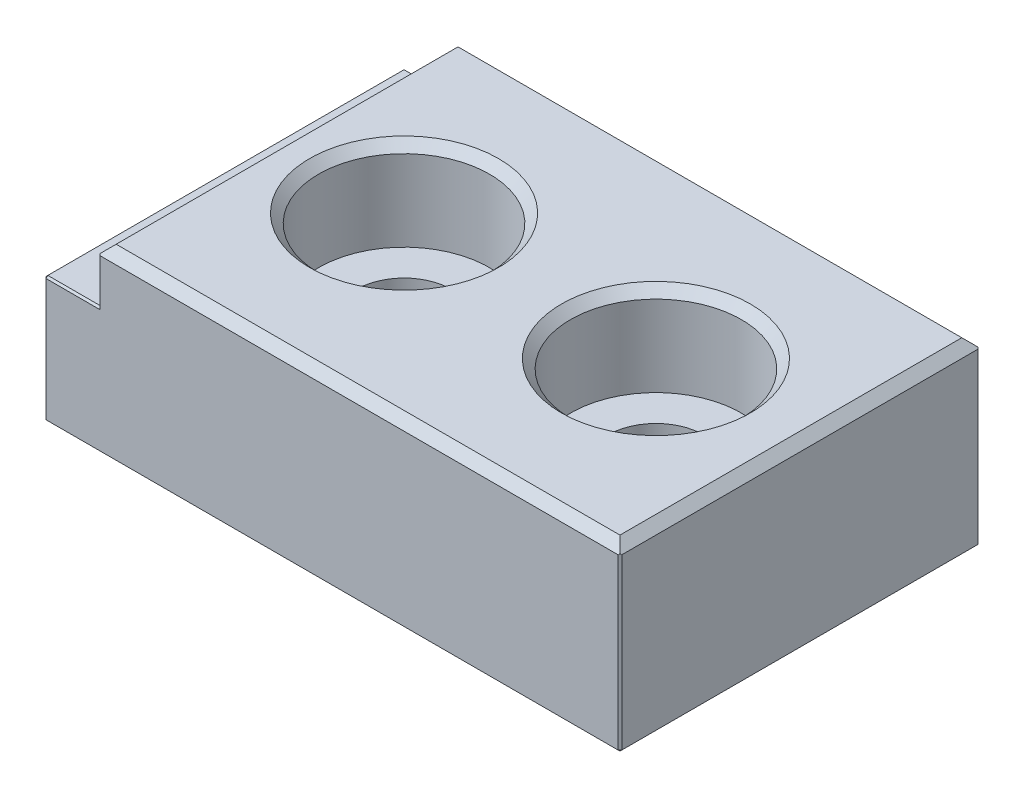
from build123d import *

# Parameters (mm, degrees)
SKETCH1_W                      = 32
SKETCH1_H                      = 20
SKETCH1_R                      = 1.5
BOSS_EXTRUDE1_DEPTH            = 10
CBORE_FOR_M5_SHCS1_D           = 5.3
CBORE_FOR_M5_SHCS1_CBORE_D     = 9.5
CBORE_FOR_M5_SHCS1_CBORE_DEPTH = 5
SKETCH7_W                      = 3
SKETCH7_H                      = 20
CUT_EXTRUDE1_DEPTH             = 3
CHAMFER1_SIZE                  = 0.5
CHAMFER2_SIZE                  = 0.1


with BuildPart() as part:
    # Sketch1 → Boss-Extrude1 (new body)
    with BuildSketch(Plane(origin=(0, 0, 0), x_dir=(1, 0, 0), z_dir=(0, 1, 0))):
        with Locations((1.866408356, 4.25)):
            Rectangle(SKETCH1_W, SKETCH1_H)
        with Locations(Location((-4.133591644, 4.25, 0), (0, 0, 270))):
            Circle(SKETCH1_R, mode=Mode.SUBTRACT)
        with Locations(Location((9.866408356, 4.25, 0), (0, 0, 270))):
            Circle(SKETCH1_R, mode=Mode.SUBTRACT)
    extrude(amount=BOSS_EXTRUDE1_DEPTH)

    # CBORE for M5 SHCS1 (through all)
    with Locations(Plane(origin=(0, 10, 0), x_dir=(1, 0, 0), z_dir=(0, 1, 0))):
        with Locations((-4.133591644, 4.25), (9.866408356, 4.25)):
            CounterBoreHole(CBORE_FOR_M5_SHCS1_D / 2, CBORE_FOR_M5_SHCS1_CBORE_D / 2, CBORE_FOR_M5_SHCS1_CBORE_DEPTH)

    # Sketch7 → Cut-Extrude1 (cut)
    with BuildSketch(Plane(origin=(0, 10, 0), x_dir=(1, 0, 0), z_dir=(0, 1, 0))):
        with Locations((-12.633591644, 4.25)):
            Rectangle(SKETCH7_W, SKETCH7_H)
    extrude(amount=-CUT_EXTRUDE1_DEPTH, mode=Mode.SUBTRACT)

    # Chamfer1
    chamfer1_edges = [part.edges().sort_by_distance(p)[0] for p in [
        (17.866408356, 10, -4.25),
        (3.366408356, 10, -14.25),
        (5.116408356, 10, -4.25),
        (-8.883591644, 10, -4.25),
        (3.366408356, 10, 5.75),
        (-11.133591644, 10, -4.25),
    ]]
    chamfer(chamfer1_edges, length=CHAMFER1_SIZE)

    # Chamfer2
    chamfer2_edges = [part.edges().sort_by_distance(p)[0] for p in [
        (12.516408356, 0, -4.25),
        (-1.483591644, 0, -4.25),
        (-14.133591644, 3.5, -14.25),
        (-14.133591644, 3.5, 5.75),
        (-14.133591644, 7, -4.25),
        (-12.633591644, 7, -14.25),
        (-11.133591644, 8.25, -14.25),
        (-12.633591644, 7, 5.75),
        (-11.133591644, 8.25, 5.75),
        (1.866408356, 0, -14.25),
        (17.866408356, 0, -4.25),
        (1.866408356, 0, 5.75),
        (-14.133591644, 0, -4.25),
        (17.866408356, 4.75, 5.75),
        (17.866408356, 4.75, -14.25),
    ]]
    chamfer(chamfer2_edges, length=CHAMFER2_SIZE)


solid = part.part
